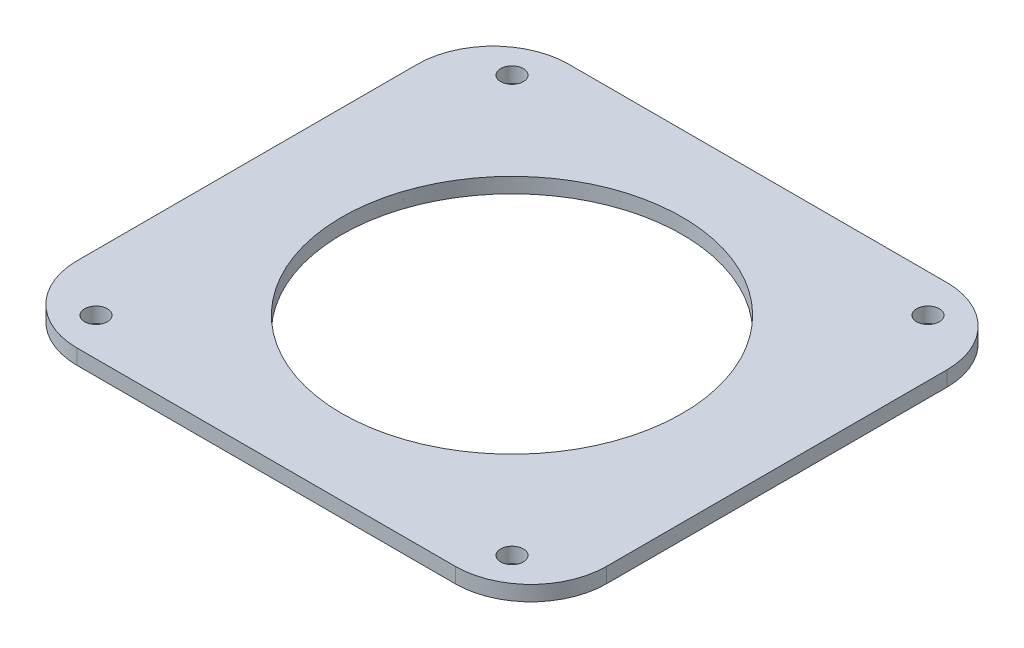
from build123d import *

# Parameters (mm, degrees)
SKETCH_1_W          = 70
SKETCH_1_H          = 65
SKETCH_1_R          = 22.5
SKETCH_1_R_2        = 1.5
EXTRUDE_1_DEPTH     = 10
FILLET_1_R          = 10
FILLET_2_R          = 10
FILLET_3_R          = 10
FILLET_4_R          = 10
SKETCH_2_W          = 161.633033244
SKETCH_2_H          = 138.385284329
CUT_EXTRUDE_1_DEPTH = 8


with BuildPart() as part:
    # 草图1 → 凸台-拉伸1 (new body)
    with BuildSketch(Plane(origin=(0, 0, 0), x_dir=(1, 0, 0), z_dir=(0, 1, 0))):
        Rectangle(SKETCH_1_W, SKETCH_1_H)
        with Locations(Location((0, 0, 0), (0, 0, 270))):
            Circle(SKETCH_1_R, mode=Mode.SUBTRACT)
        with Locations(Location((-27.5, 27.5, 0), (0, 0, 270))):
            Circle(SKETCH_1_R_2, mode=Mode.SUBTRACT)
        with Locations(Location((-27.5, -27.5, 0), (0, 0, 270))):
            Circle(SKETCH_1_R_2, mode=Mode.SUBTRACT)
        with Locations(Location((27.5, -27.5, 0), (0, 0, 270))):
            Circle(SKETCH_1_R_2, mode=Mode.SUBTRACT)
        with Locations(Location((27.5, 27.5, 0), (0, 0, 270))):
            Circle(SKETCH_1_R_2, mode=Mode.SUBTRACT)
    extrude(amount=EXTRUDE_1_DEPTH)

    # 圆角1
    fillet_1_edges = [part.edges().sort_by_distance(p)[0] for p in [
        (-35, 5, -32.5),
    ]]
    fillet(fillet_1_edges, radius=FILLET_1_R)

    # 圆角2
    fillet_2_edges = [part.edges().sort_by_distance(p)[0] for p in [
        (35, 5, -32.5),
    ]]
    fillet(fillet_2_edges, radius=FILLET_2_R)

    # 圆角3
    fillet_3_edges = [part.edges().sort_by_distance(p)[0] for p in [
        (-35, 5, 32.5),
    ]]
    fillet(fillet_3_edges, radius=FILLET_3_R)

    # 圆角4
    fillet_4_edges = [part.edges().sort_by_distance(p)[0] for p in [
        (35, 5, 32.5),
    ]]
    fillet(fillet_4_edges, radius=FILLET_4_R)

    # 草图2 → 切除-拉伸1 (cut)
    with BuildSketch(Plane(origin=(0, 10, 0), x_dir=(1, 0, 0), z_dir=(0, 1, 0))):
        with Locations((-39.612940585, 34.19866222)):
            Rectangle(SKETCH_2_W, SKETCH_2_H)
    extrude(amount=-CUT_EXTRUDE_1_DEPTH, mode=Mode.SUBTRACT)


solid = part.part
